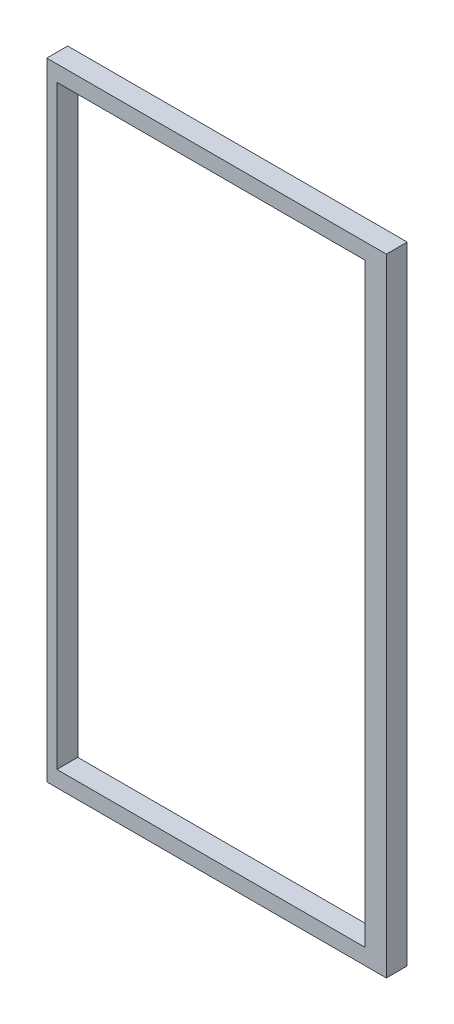
from build123d import *

# Parameters (mm, degrees)
SKETCH1_W           = 65
SKETCH1_H           = 120
SKETCH1_W_2         = 59
SKETCH1_H_2         = 113.91031769
BOSS_EXTRUDE1_DEPTH = 4


with BuildPart() as part:
    # Sketch1 → Boss-Extrude1 (new body)
    with BuildSketch(Plane.XY):
        with Locations((11.209588399, 0)):
            Rectangle(SKETCH1_W, SKETCH1_H)
        with Locations((10.144224581, 0)):
            Rectangle(SKETCH1_W_2, SKETCH1_H_2, mode=Mode.SUBTRACT)
    extrude(amount=BOSS_EXTRUDE1_DEPTH)


solid = part.part
